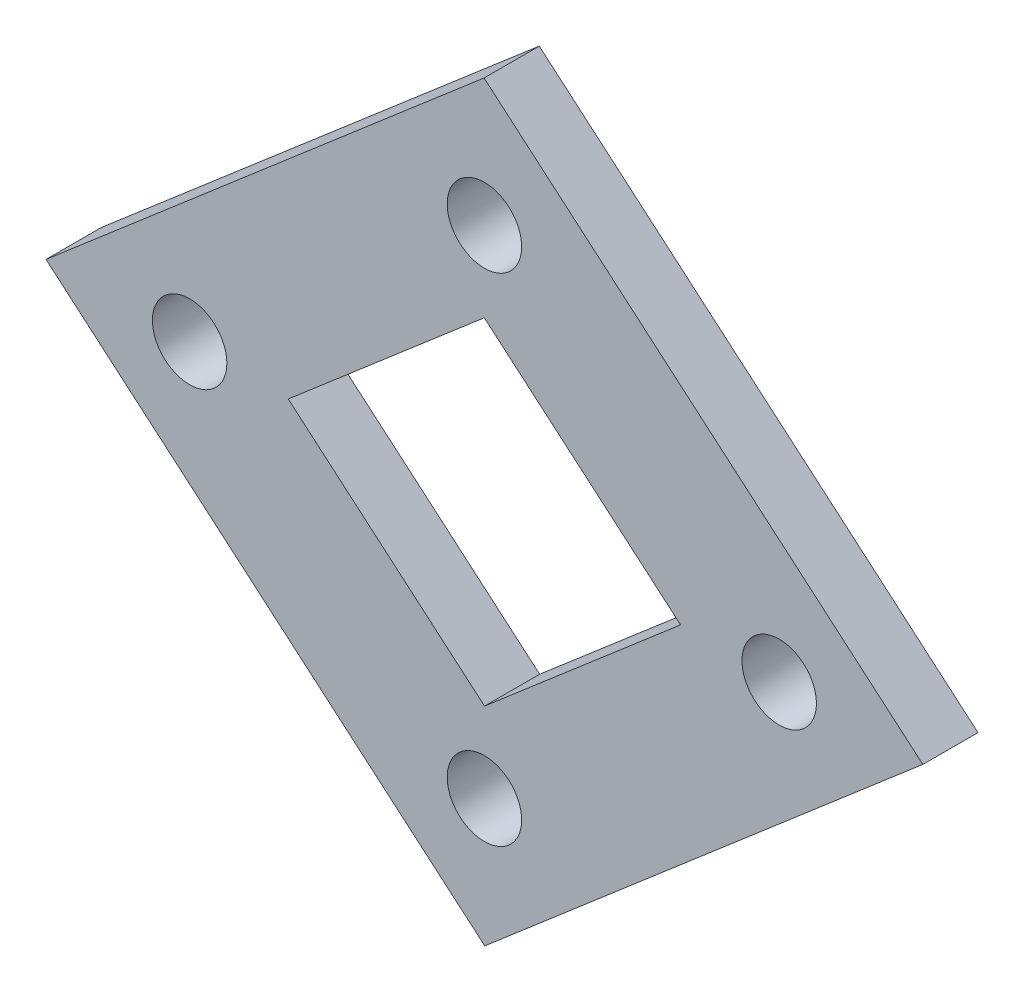
from build123d import *

# Parameters (mm, degrees)
SKETCH1_R           = 1.2
BOSS_EXTRUDE1_DEPTH = 1.778
CUT_EXTRUDE1_REACH  = 20.691


with BuildPart() as part:
    # Sketch1 → Boss-Extrude1 (new body)
    with BuildSketch(Plane.XY):
        Polygon((-14.129156365, -0.016893901), (0.010881059, -12.106513676), (14.129156365, 0.016893901), (-0.010881059, 12.106513676), align=None)
        with Locations((0, 8)):
            Circle(SKETCH1_R, mode=Mode.SUBTRACT)
        with Locations((-9.5, 0)):
            Circle(SKETCH1_R, mode=Mode.SUBTRACT)
        with Locations((9.5, 0)):
            Circle(SKETCH1_R, mode=Mode.SUBTRACT)
        with Locations((0, -8)):
            Circle(SKETCH1_R, mode=Mode.SUBTRACT)
    extrude(amount=BOSS_EXTRUDE1_DEPTH)

    # Sketch2 → Cut-Extrude1 (cut, up to next)
    with BuildSketch(Plane.XY.offset(1.778), mode=Mode.PRIVATE) as cut_extrude1_sk1:
        Polygon((-0.003723131, 5.416744003), (-6.321720276, -0.008540092), (0.003723131, -5.416744003), (6.321720276, 0.008540092), align=None)
    cut_extrude1_tool1 = extrude(cut_extrude1_sk1.sketch, amount=-CUT_EXTRUDE1_REACH, mode=Mode.PRIVATE) & part.part
    add(cut_extrude1_tool1.solids().sort_by_distance((0, 0, 1.778))[0], mode=Mode.SUBTRACT)


solid = part.part
